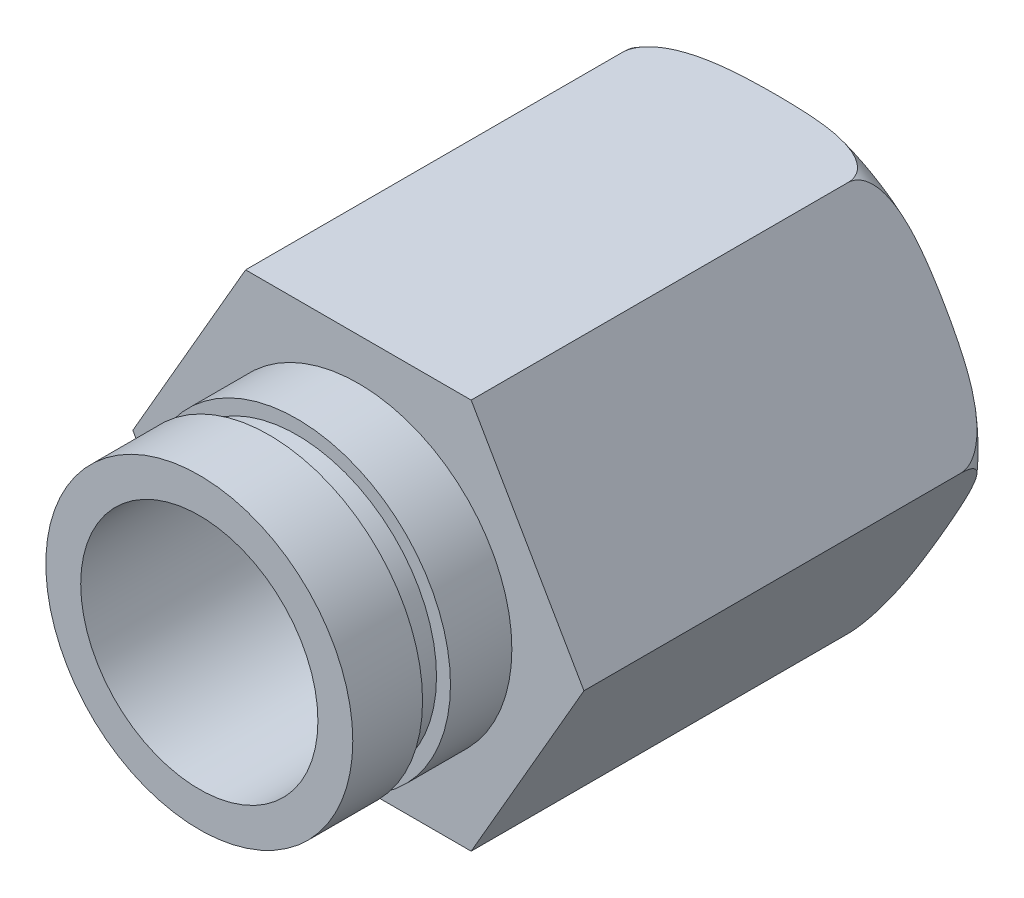
from build123d import *

# Parameters (mm, degrees)
EXTRUDE_1_DEPTH     = 15
SKETCH_2_R          = 5.5
EXTRUDE_2_DEPTH     = 5.7
SKETCH_3_R          = 4.25
CUT_EXTRUDE_1_DEPTH = 12.7
M8X1_25_1_D         = 8
SKETCH_8_W          = 0.5
SKETCH_8_H          = 1


with BuildPart() as part:
    # 草图1 → 凸台-拉伸1 (new body)
    with BuildSketch(Plane.XY):
        Polygon((-8.082903769, 0), (-4.041451884, -7), (4.041451884, -7), (8.082903769, 0), (4.041451884, 7), (-4.041451884, 7), align=None)
    extrude(amount=EXTRUDE_1_DEPTH)

    # 草图2 → 凸台-拉伸2 (add)
    with BuildSketch(Plane.XY.offset(15)):
        Circle(SKETCH_2_R)
    extrude(amount=EXTRUDE_2_DEPTH)

    # 草图3 → 切除-拉伸1 (cut)
    with BuildSketch(Plane.XY.offset(20.7)):
        Circle(SKETCH_3_R)
    extrude(amount=-CUT_EXTRUDE_1_DEPTH, mode=Mode.SUBTRACT)

    # M8x1.25 螺纹孔1 (through all)
    with Locations(Plane(origin=(0, 0, 0), x_dir=(-1, 0, 0), z_dir=(0, 0, -1))):
        with Locations((0, 0)):
            Hole(M8X1_25_1_D / 2)

    # 草图8 → 切除-旋转1 (revolve, cut)
    with BuildSketch(Plane(origin=(0, 0, 0), x_dir=(1, 0, 0), z_dir=(0, 1, 0)), mode=Mode.PRIVATE) as cut_revolve_1_sk:
        with Locations((-5.25, -17.7)):
            Rectangle(SKETCH_8_W, SKETCH_8_H)
    revolve(cut_revolve_1_sk.sketch.rotate(Axis((0, 0, 8), (0, 0, -1)), 180), axis=Axis((0, 0, 8), (0, 0, -1)), mode=Mode.SUBTRACT)

    # 草图9 → 切除-旋转2 (revolve, cut)
    with BuildSketch(Plane(origin=(0, 0, 0), x_dir=(1, 0, 0), z_dir=(0, 1, 0))):
        with BuildLine():
            Line((-8.082903769, -1.5), (-8.082903769, 0))
            Line((-8.082903769, 0), (-6.582903769, 0))
            ThreePointArc((-6.582903769, 0), (-7.64356394, -0.439339828), (-8.082903769, -1.5))
        make_face()
    revolve(axis=Axis((0, 0, 8), (0, 0, -1)), mode=Mode.SUBTRACT)


solid = part.part
